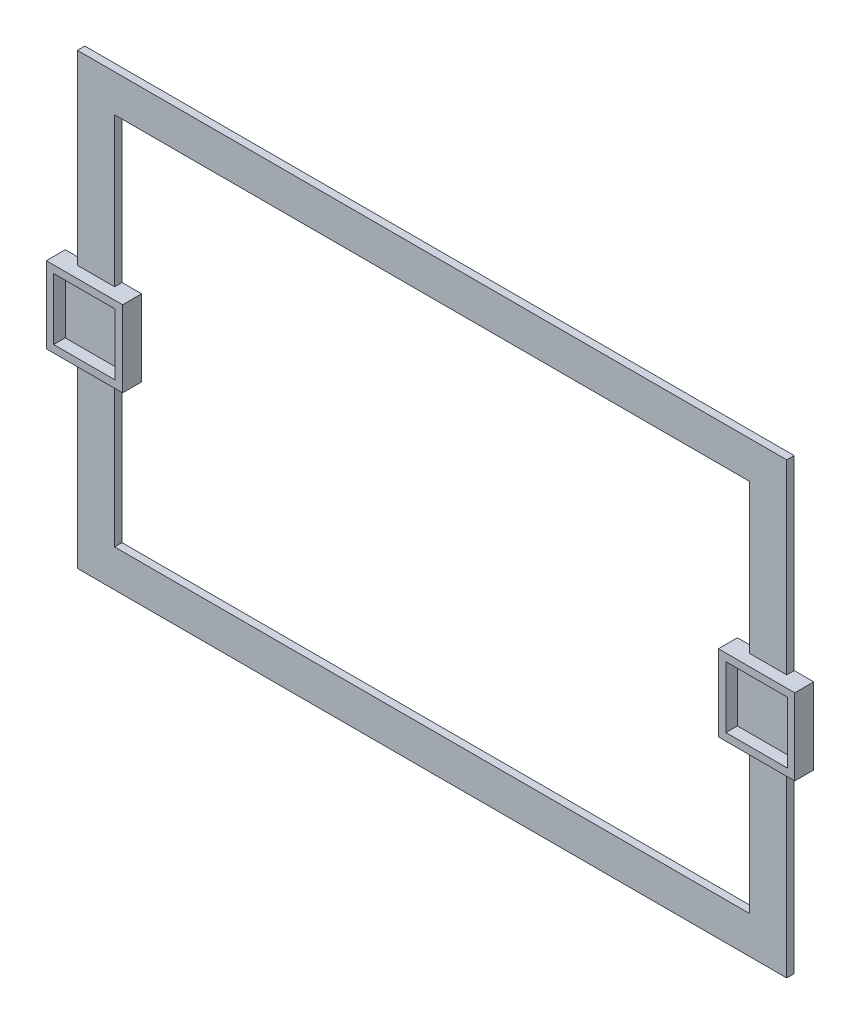
from build123d import *

# Parameters (mm, degrees)
SKETCH1_W             = 52.07
SKETCH1_H             = 52.07
SKETCH1_W_2           = 41.91
SKETCH1_H_2           = 41.91
BOSS_EXTRUDE1_DEPTH   = 7.874
BOSS_EXTRUDE1_2_DEPTH = 7.874
BOSS_EXTRUDE3_DEPTH   = 5.08
BOSS_EXTRUDE3_2_DEPTH = 5.08
SKETCH3_W             = 52.07
SKETCH3_H             = 52.07
BOSS_EXTRUDE4_DEPTH   = 5.08


with BuildPart() as part:
    # Sketch1 → Boss-Extrude1 (new body)
    with BuildSketch(Plane.XY):
        with Locations((20.955, 20.955)):
            Rectangle(SKETCH1_W, SKETCH1_H)
        with Locations((20.955, 20.955)):
            Rectangle(SKETCH1_W_2, SKETCH1_H_2, mode=Mode.SUBTRACT)
    extrude(amount=BOSS_EXTRUDE1_DEPTH)



with BuildPart() as body_2:
    # Sketch1 → Boss-Extrude1 2 (new body)
    with BuildSketch(Plane.XY):
        with Locations((479.425, 20.955)):
            Rectangle(SKETCH1_W, SKETCH1_H)
        with Locations((479.425, 20.955)):
            Rectangle(SKETCH1_W_2, SKETCH1_H_2, mode=Mode.SUBTRACT)
    extrude(amount=BOSS_EXTRUDE1_2_DEPTH)


with BuildPart() as body_3:
    # Sketch2 → Boss-Extrude3 (new body)
    with BuildSketch(Plane(origin=(0, 0, 0), x_dir=(-1, 0, 0), z_dir=(0, 0, -1))):
        Polygon((-8.255, -132.08), (-8.255, -5.08), (-33.655, -5.08), (-33.655, -106.68), (-466.725, -106.68), (-466.725, -5.08), (-492.125, -5.08), (-492.125, -132.08), align=None)
    extrude(amount=BOSS_EXTRUDE3_DEPTH)


with BuildPart() as body_4:
    # Sketch2 → Boss-Extrude3 2 (new body)
    with BuildSketch(Plane(origin=(0, 0, 0), x_dir=(-1, 0, 0), z_dir=(0, 0, -1))):
        Polygon((-33.655, 46.99), (-8.255, 46.99), (-8.255, 173.99), (-492.125, 173.99), (-492.125, 46.99), (-466.725, 46.99), (-466.725, 148.59), (-33.655, 148.59), align=None)
    extrude(amount=BOSS_EXTRUDE3_2_DEPTH)


with BuildPart() as part_1:
    add(part.part)

    add(body_2.part)  # Boss-Extrude4 merges body 2

    add(body_3.part)  # Boss-Extrude4 merges body 3

    add(body_4.part)  # Boss-Extrude4 merges body 4
    # Sketch3 → Boss-Extrude4 (add)
    with BuildSketch(Plane(origin=(0, 0, 0), x_dir=(-1, 0, 0), z_dir=(0, 0, -1))):
        with Locations((-20.955, 20.955)):
            Rectangle(SKETCH3_W, SKETCH3_H)
        with Locations((-479.425, 20.955)):
            Rectangle(SKETCH3_W, SKETCH3_H)
    extrude(amount=BOSS_EXTRUDE4_DEPTH)


solid = part_1.part
